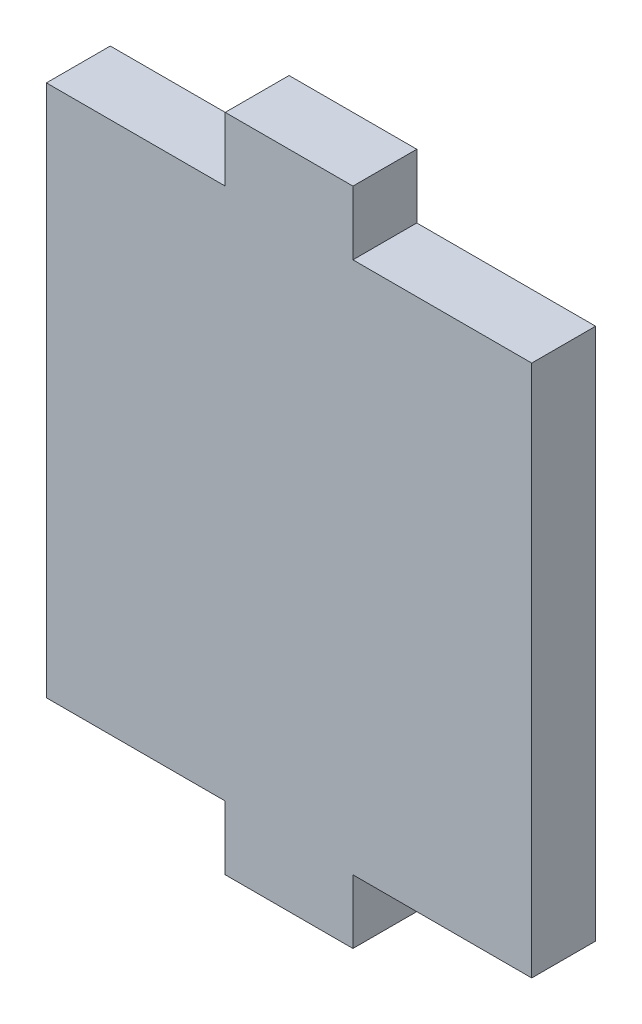
from build123d import *

# Parameters (mm, degrees)
BOSS_EXTRUDE1_DEPTH = 5


with BuildPart() as part:
    # Sketch2 → Boss-Extrude1 (new body)
    with BuildSketch(Plane.XY):
        Polygon((-5, -25.85), (-5, -20.85), (-19, -20.85), (-19, 20.85), (-5, 20.85), (-5, 25.85), (5, 25.85), (5, 20.85), (19, 20.85), (19, -20.85), (5, -20.85), (5, -25.85), align=None)
    extrude(amount=BOSS_EXTRUDE1_DEPTH)


solid = part.part
